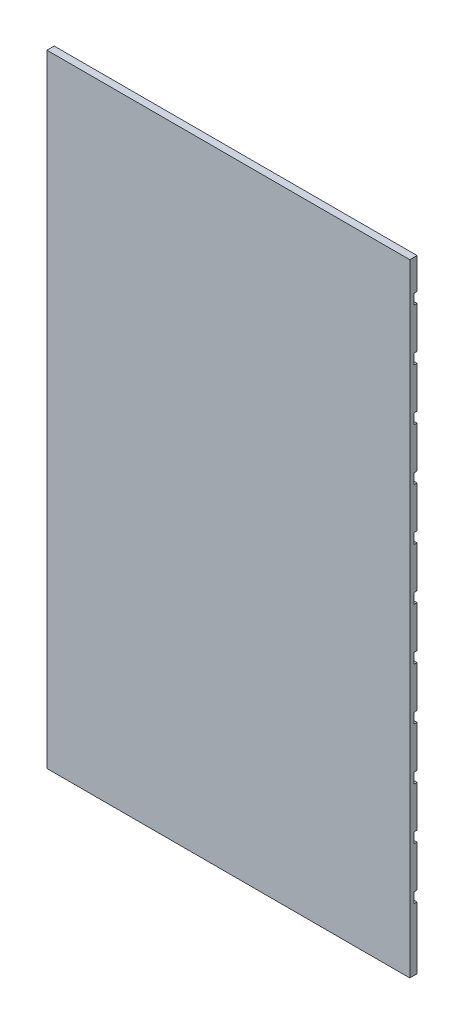
from build123d import *

# Parameters (mm, degrees)
SKETCH2_W           = 17.78
SKETCH2_H           = 1524
BOSS_EXTRUDE1_DEPTH = 889
SKETCH3_W           = 889
SKETCH3_H           = 25.4
CUT_EXTRUDE1_DEPTH  = 7.62


with BuildPart() as part:
    # Sketch2 → Boss-Extrude1 (new body)
    with BuildSketch(Plane(origin=(0, 0, 0), x_dir=(0, 0, -1), z_dir=(1, 0, 0))):
        with Locations((8.89, -762)):
            Rectangle(SKETCH2_W, SKETCH2_H)
    extrude(amount=BOSS_EXTRUDE1_DEPTH)

    # Sketch3 → Cut-Extrude1 (cut)
    with BuildSketch(Plane(origin=(0, 0, -17.78), x_dir=(-1, 0, 0), z_dir=(0, 0, -1))):
        with Locations((-444.5, -88.9)):
            Rectangle(SKETCH3_W, SKETCH3_H)
        with Locations((-444.5, -215.9)):
            Rectangle(SKETCH3_W, SKETCH3_H)
        with Locations((-444.5, -342.9)):
            Rectangle(SKETCH3_W, SKETCH3_H)
        with Locations((-444.5, -469.9)):
            Rectangle(SKETCH3_W, SKETCH3_H)
        with Locations((-444.5, -596.9)):
            Rectangle(SKETCH3_W, SKETCH3_H)
        with Locations((-444.5, -723.9)):
            Rectangle(SKETCH3_W, SKETCH3_H)
        with Locations((-444.5, -850.9)):
            Rectangle(SKETCH3_W, SKETCH3_H)
        with Locations((-444.5, -977.9)):
            Rectangle(SKETCH3_W, SKETCH3_H)
        with Locations((-444.5, -1104.9)):
            Rectangle(SKETCH3_W, SKETCH3_H)
        with Locations((-444.5, -1231.9)):
            Rectangle(SKETCH3_W, SKETCH3_H)
        with Locations((-444.5, -1358.9)):
            Rectangle(SKETCH3_W, SKETCH3_H)
    extrude(amount=-CUT_EXTRUDE1_DEPTH, mode=Mode.SUBTRACT)


solid = part.part
